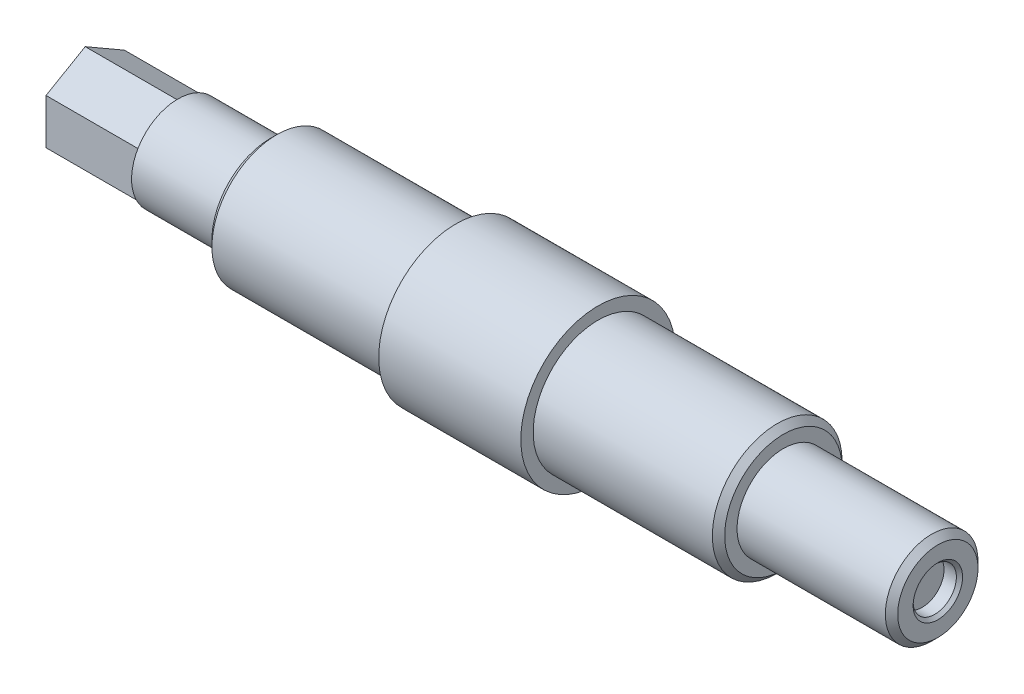
from build123d import *

# Parameters (mm, degrees)
EXTRUDE_1_DEPTH     = 15
M5X0_8_1_D          = 4.2
M5X0_8_1_DEPTH      = 12.4
M5X0_8_1_TIP        = 1.2618073
SKETCH_5_R          = 7.5
EXTRUDE_2_DEPTH     = 15
SKETCH_6_R          = 10.5
EXTRUDE_3_DEPTH     = 30
SKETCH_7_R          = 12.5
EXTRUDE_4_DEPTH     = 23
SKETCH_8_R          = 10.5
EXTRUDE_5_DEPTH     = 30
CHAMFER_1_SIZE      = 1
CHAMFER_2_SIZE      = 1
SKETCH_9_R          = 7.5
EXTRUDE_6_DEPTH     = 25
CHAMFER_3_SIZE      = 1
SKETCH_10_R         = 3.5
CUT_EXTRUDE_1_DEPTH = 2.5
CHAMFER_4_SIZE      = 0.5


with BuildPart() as part:
    # 草图1 → 凸台-拉伸1 (new body)
    with BuildSketch(Plane(origin=(0, 0, 0), x_dir=(0, 0, -1), z_dir=(1, 0, 0))):
        Polygon((0, -7.332348419), (6.35, -3.666174209), (6.35, 3.666174209), (0, 7.332348419), (-6.35, 3.666174209), (-6.35, -3.666174209), align=None)
    extrude(amount=EXTRUDE_1_DEPTH)

    # M5x0.8 螺纹孔1
    with Locations(Plane.ZY):
        with Locations((0, 0)):
            Hole(M5X0_8_1_D / 2, depth=M5X0_8_1_DEPTH)
            with Locations((0, 0, -(M5X0_8_1_DEPTH + M5X0_8_1_TIP / 2))):  # 118° drill point
                Cone(0, M5X0_8_1_D / 2, M5X0_8_1_TIP, mode=Mode.SUBTRACT)

    # 草图5 → 凸台-拉伸2 (add)
    with BuildSketch(Plane(origin=(15, 0, 0), x_dir=(0, 0, -1), z_dir=(1, 0, 0))):
        Circle(SKETCH_5_R)
    extrude(amount=EXTRUDE_2_DEPTH)

    # 草图6 → 凸台-拉伸3 (add)
    with BuildSketch(Plane(origin=(30, 0, 0), x_dir=(0, 0, -1), z_dir=(1, 0, 0))):
        Circle(SKETCH_6_R)
    extrude(amount=EXTRUDE_3_DEPTH)

    # 草图7 → 凸台-拉伸4 (add)
    with BuildSketch(Plane(origin=(60, 0, 0), x_dir=(0, 0, -1), z_dir=(1, 0, 0))):
        Circle(SKETCH_7_R)
    extrude(amount=EXTRUDE_4_DEPTH)

    # 草图8 → 凸台-拉伸5 (add)
    with BuildSketch(Plane(origin=(83, 0, 0), x_dir=(0, 0, -1), z_dir=(1, 0, 0))):
        Circle(SKETCH_8_R)
    extrude(amount=EXTRUDE_5_DEPTH)

    # 倒角1
    chamfer_1_edges = [part.edges().sort_by_distance(p)[0] for p in [
        (30, 0, 10.5),
    ]]
    chamfer(chamfer_1_edges, length=CHAMFER_1_SIZE)

    # 倒角2
    chamfer_2_edges = [part.edges().sort_by_distance(p)[0] for p in [
        (113, 0, 10.5),
    ]]
    chamfer(chamfer_2_edges, length=CHAMFER_2_SIZE)

    # 草图9 → 凸台-拉伸6 (add)
    with BuildSketch(Plane(origin=(113, 0, 0), x_dir=(0, 0, -1), z_dir=(1, 0, 0))):
        Circle(SKETCH_9_R)
    extrude(amount=EXTRUDE_6_DEPTH)

    # 倒角3
    chamfer_3_edges = [part.edges().sort_by_distance(p)[0] for p in [
        (138, 0, 7.5),
    ]]
    chamfer(chamfer_3_edges, length=CHAMFER_3_SIZE)

    # 草图10 → 切除-拉伸1 (cut)
    with BuildSketch(Plane(origin=(138, 0, 0), x_dir=(0, 0, -1), z_dir=(1, 0, 0))):
        Circle(SKETCH_10_R)
    extrude(amount=-CUT_EXTRUDE_1_DEPTH, mode=Mode.SUBTRACT)

    # 倒角4
    chamfer_4_edges = [part.edges().sort_by_distance(p)[0] for p in [
        (138, 0, 3.5),
    ]]
    chamfer(chamfer_4_edges, length=CHAMFER_4_SIZE)


solid = part.part
